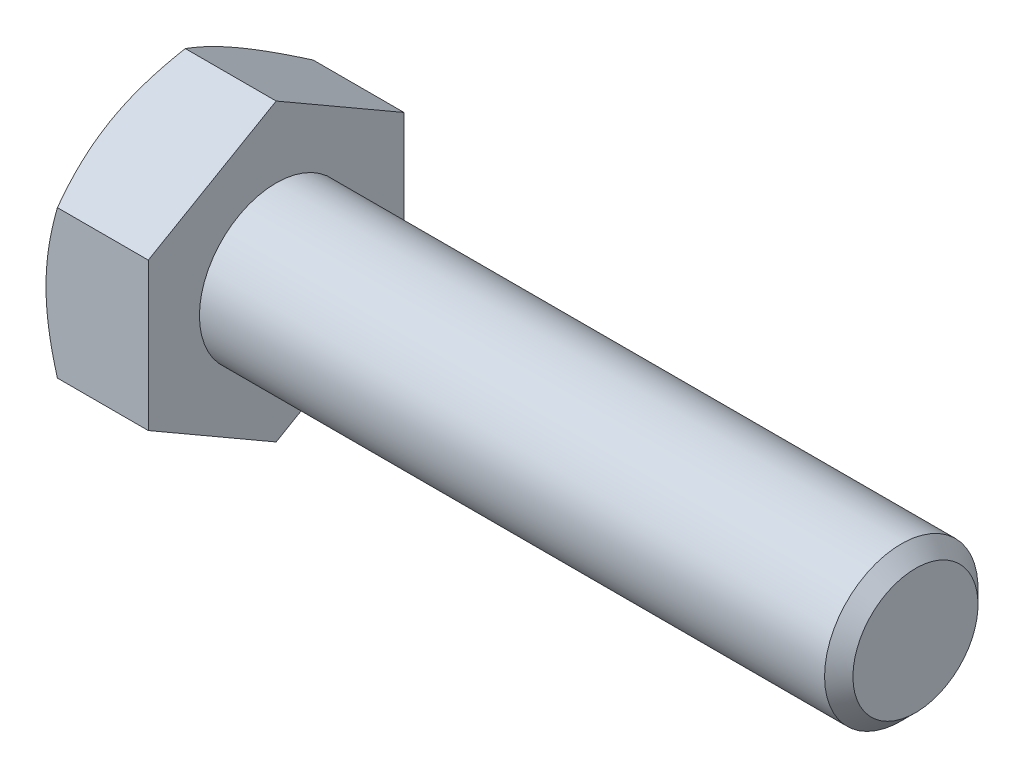
from build123d import *

# Parameters (mm, degrees)
BASEHEAD_DEPTH = 4


with BuildPart() as part:
    # Sketch1 → BaseHead (new body)
    with BuildSketch(Plane(origin=(0, 0, 0), x_dir=(0, 0, -1), z_dir=(1, 0, 0))):
        Polygon((5, 2.886751346), (5, -2.886751346), (0, -5.773502692), (-5, -2.886751346), (-5, 2.886751346), (0, 5.773502692), align=None)
    extrude(amount=BASEHEAD_DEPTH)

    # BodySke → BaseBody (revolve)
    with BuildSketch(Plane.XY, mode=Mode.PRIVATE) as basebody_sk:
        Polygon((0, 0), (29, 0), (29, 2.4455), (28.4455, 3), (0, 3), align=None)
    revolve(basebody_sk.sketch.rotate(Axis((0, 0, 0), (1, 0, 0)), 90), axis=Axis((0, 0, 0), (1, 0, 0)))

    # Sketch3 → HeadChamfer (revolve, cut)
    with BuildSketch(Plane.XY):
        Polygon((0, 5), (3.333333333, 10.773502692), (3.333333333, 15.773502692), (-10, 15.773502692), (-10, 5), align=None)
    revolve(axis=Axis((0, 0, 0), (1, 0, 0)), mode=Mode.SUBTRACT)


solid = part.part
